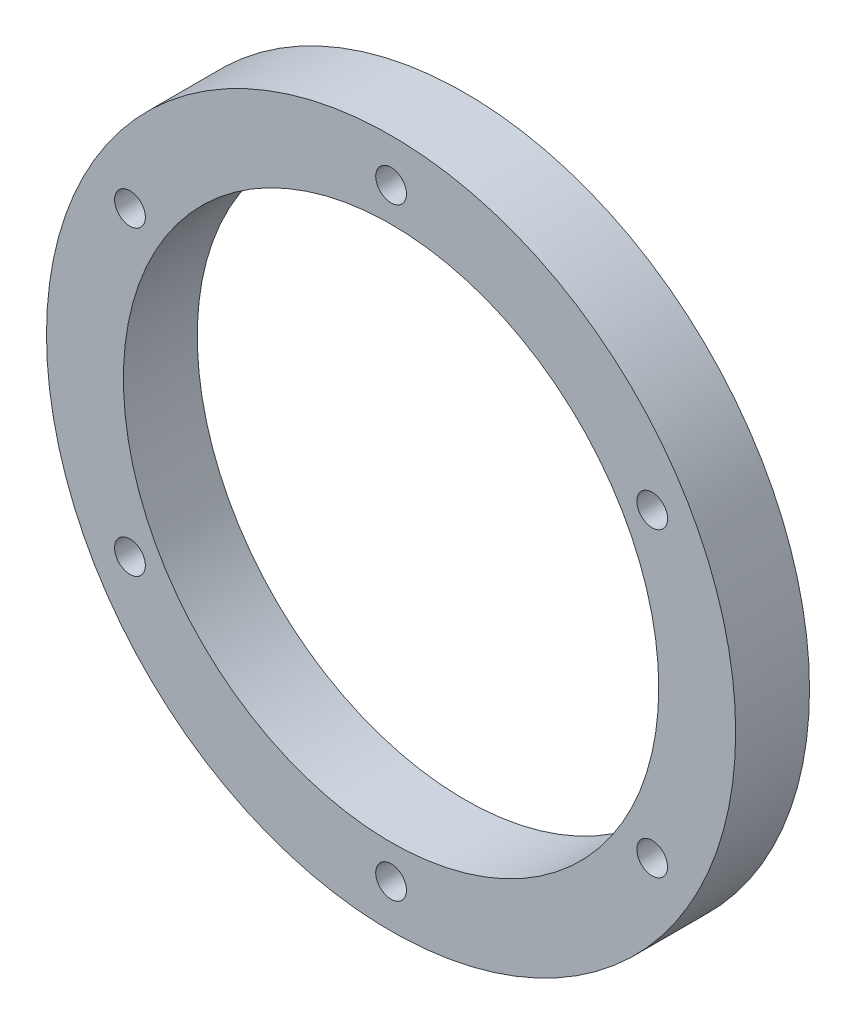
from build123d import *

# Parameters (mm, degrees)
SKETCH_1_R      = 28
SKETCH_1_R_2    = 1.25
SKETCH_1_R_3    = 21.75
EXTRUDE_1_DEPTH = 6


with BuildPart() as part:
    # 草图1 → 凸台-拉伸1 (new body)
    with BuildSketch(Plane.XY):
        Circle(SKETCH_1_R)
        with Locations((0, 24.5)):
            Circle(SKETCH_1_R_2, mode=Mode.SUBTRACT)
        Circle(SKETCH_1_R_3, mode=Mode.SUBTRACT)
        with Locations((21.217622393, 12.25)):
            Circle(SKETCH_1_R_2, mode=Mode.SUBTRACT)
        with Locations((21.217622393, -12.25)):
            Circle(SKETCH_1_R_2, mode=Mode.SUBTRACT)
        with Locations((0, -24.5)):
            Circle(SKETCH_1_R_2, mode=Mode.SUBTRACT)
        with Locations((-21.217622393, -12.25)):
            Circle(SKETCH_1_R_2, mode=Mode.SUBTRACT)
        with Locations((-21.217622393, 12.25)):
            Circle(SKETCH_1_R_2, mode=Mode.SUBTRACT)
    extrude(amount=EXTRUDE_1_DEPTH)


solid = part.part
